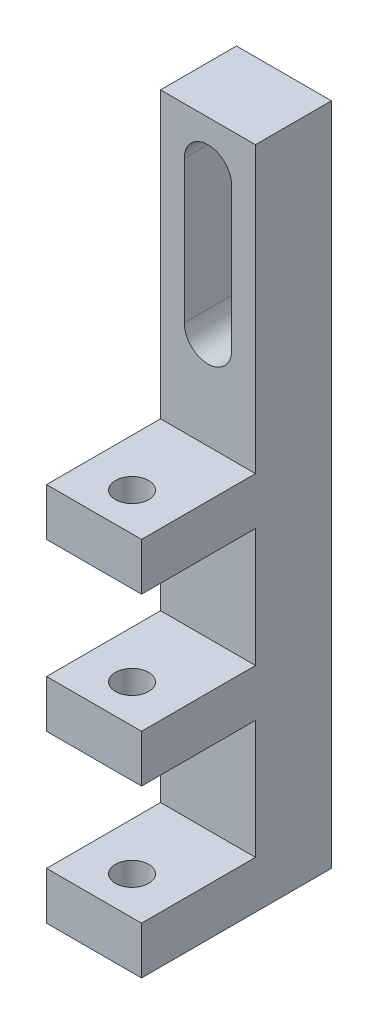
from build123d import *

# Parameters (mm, degrees)
SKETCH_1_W          = 10
SKETCH_1_H          = 20
SKETCH_1_R          = 2.5
EXTRUDE_1_DEPTH     = 5
SKETCH_1_H_2        = 12.5
EXTRUDE_1_2_DEPTH   = 5
EXTRUDE_1_3_DEPTH   = 5
SKETCH_1_3_W        = 10
SKETCH_1_3_H        = 5
EXTRUDE_2_DEPTH     = 17
SKETCH_2_R          = 1.75
CUT_EXTRUDE_1_DEPTH = 49
SKETCH_3_W          = 3
SKETCH_3_H          = 60
EXTRUDE_3_DEPTH     = 10
SKETCH_4_W          = 10
SKETCH_4_H          = 10
SKETCH_4_R          = 2.5
EXTRUDE_4_DEPTH     = 8
CUT_EXTRUDE_2_DEPTH = 8


with BuildPart() as part:
    # 草图1 → 凸台-拉伸1 (new body)
    with BuildSketch(Plane.XY):
        with Locations((0.505617978, 15.224719101)):
            Rectangle(SKETCH_1_W, SKETCH_1_H)
        with Locations((0.505617978, 15.224719101)):
            Circle(SKETCH_1_R, mode=Mode.SUBTRACT)
    extrude(amount=EXTRUDE_1_DEPTH)



with BuildPart() as body_2:
    # 草图1 → Extrude 1 2 (new body)
    with BuildSketch(Plane.XY):
        with Locations((0.505617978, -6.025280899)):
            Rectangle(SKETCH_1_W, SKETCH_1_H_2)
    extrude(amount=EXTRUDE_1_2_DEPTH)


with BuildPart() as body_3:
    # 草图1 → Extrude 1 3 (new body)
    with BuildSketch(Plane.XY):
        with Locations((0.505617978, -23.525280899)):
            Rectangle(SKETCH_1_W, SKETCH_1_H_2)
    extrude(amount=EXTRUDE_1_3_DEPTH)


with BuildPart() as part_1:
    add(part.part)

    add(body_2.part)  # 凸台-拉伸2 merges body 2

    add(body_3.part)  # 凸台-拉伸2 merges body 3
    # 草图1<3> → 凸台-拉伸2 (add)
    with BuildSketch(Plane.XY):
        with Locations((0.505617978, 2.724719101)):
            Rectangle(SKETCH_1_3_W, SKETCH_1_3_H)
        with Locations((0.505617978, -14.775280899)):
            Rectangle(SKETCH_1_3_W, SKETCH_1_3_H)
        with Locations((0.505617978, -32.275280899)):
            Rectangle(SKETCH_1_3_W, SKETCH_1_3_H)
    extrude(amount=EXTRUDE_2_DEPTH)

    # 草图2 → 切除-拉伸1 (cut)
    with BuildSketch(Plane(origin=(0, 5.224719101, 0), x_dir=(1, 0, 0), z_dir=(0, 1, 0))):
        with Locations((0.505617978, -13)):
            Circle(SKETCH_2_R)
    extrude(amount=-CUT_EXTRUDE_1_DEPTH, mode=Mode.SUBTRACT)

    # 草图3 → 凸台-拉伸3 (add)
    with BuildSketch(Plane(origin=(5.505617978, 0, 0), x_dir=(0, 0, -1), z_dir=(1, 0, 0))):
        with Locations((1.5, -4.775280899)):
            Rectangle(SKETCH_3_W, SKETCH_3_H)
    extrude(amount=-EXTRUDE_3_DEPTH)

    # 草图4 → 凸台-拉伸4 (add)
    with BuildSketch(Plane.XY.offset(5)):
        with Locations((0.505617978, 30.224719101)):
            Rectangle(SKETCH_4_W, SKETCH_4_H)
        with Locations((0.505617978, 30.224719101)):
            Circle(SKETCH_4_R, mode=Mode.SUBTRACT)
    extrude(amount=-EXTRUDE_4_DEPTH)

    # 草图6 → 切除-拉伸2 (cut)
    with BuildSketch(Plane.XY.offset(5)):
        with BuildLine():
            Line((3.005617978, 15.224719101), (3.005617978, 30.224719101))
            ThreePointArc((3.005617978, 30.224719101), (0.505617978, 32.724719101), (-1.994382022, 30.224719101))
            Line((-1.994382022, 30.224719101), (-1.994382022, 15.224719101))
            ThreePointArc((-1.994382022, 15.224719101), (0.505617978, 12.724719101), (3.005617978, 15.224719101))
        make_face()
    extrude(amount=-CUT_EXTRUDE_2_DEPTH, mode=Mode.SUBTRACT)


solid = part_1.part
